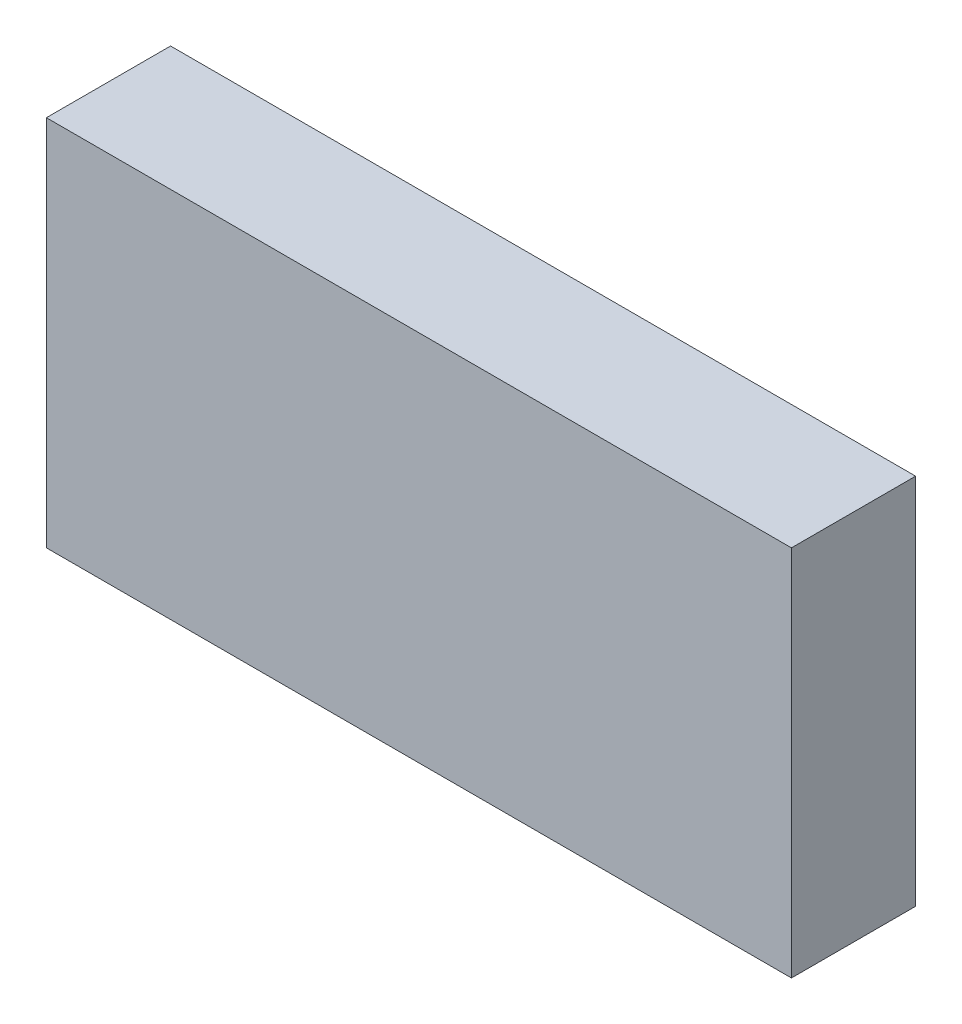
from build123d import *

# Parameters (mm, degrees)
SKETCH1_W           = 90
SKETCH1_H           = 45
BOSS_EXTRUDE1_DEPTH = 15


with BuildPart() as part:
    # Sketch1 → Boss-Extrude1 (new body)
    with BuildSketch(Plane.XY):
        Rectangle(SKETCH1_W, SKETCH1_H)
    extrude(amount=BOSS_EXTRUDE1_DEPTH)


solid = part.part
